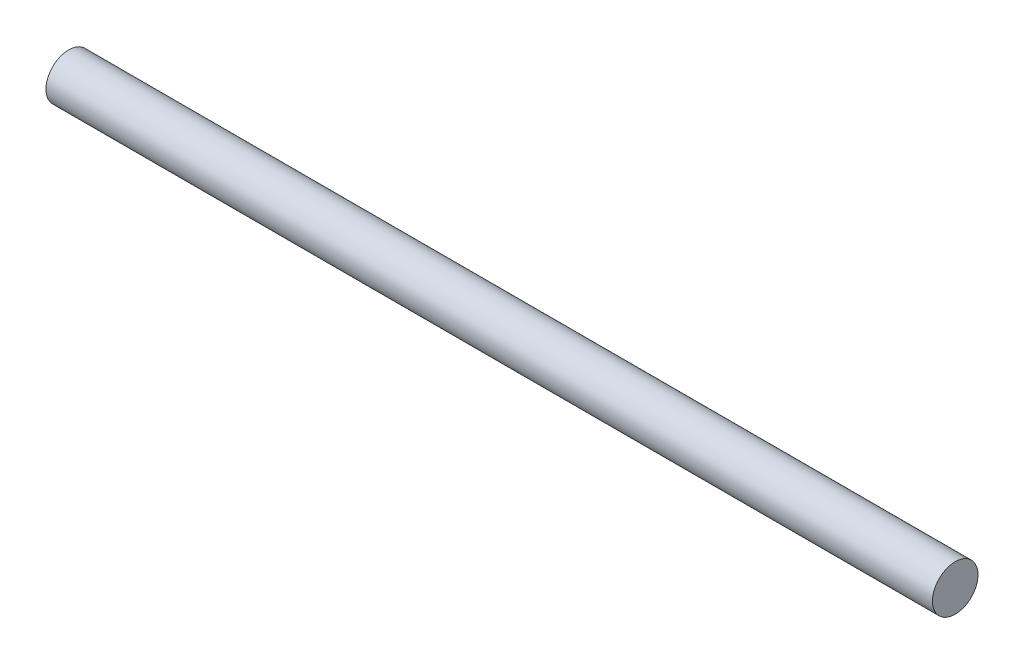
from build123d import *

# Parameters (mm, degrees)
SKETCH1_R           = 0.2921
BOSS_EXTRUDE1_DEPTH = 11.37


with BuildPart() as part:
    # Sketch1 → Boss-Extrude1 (new body)
    with BuildSketch(Plane(origin=(0, 0, 0), x_dir=(0, 0, -1), z_dir=(1, 0, 0))):
        Circle(SKETCH1_R)
    extrude(amount=BOSS_EXTRUDE1_DEPTH)


solid = part.part
